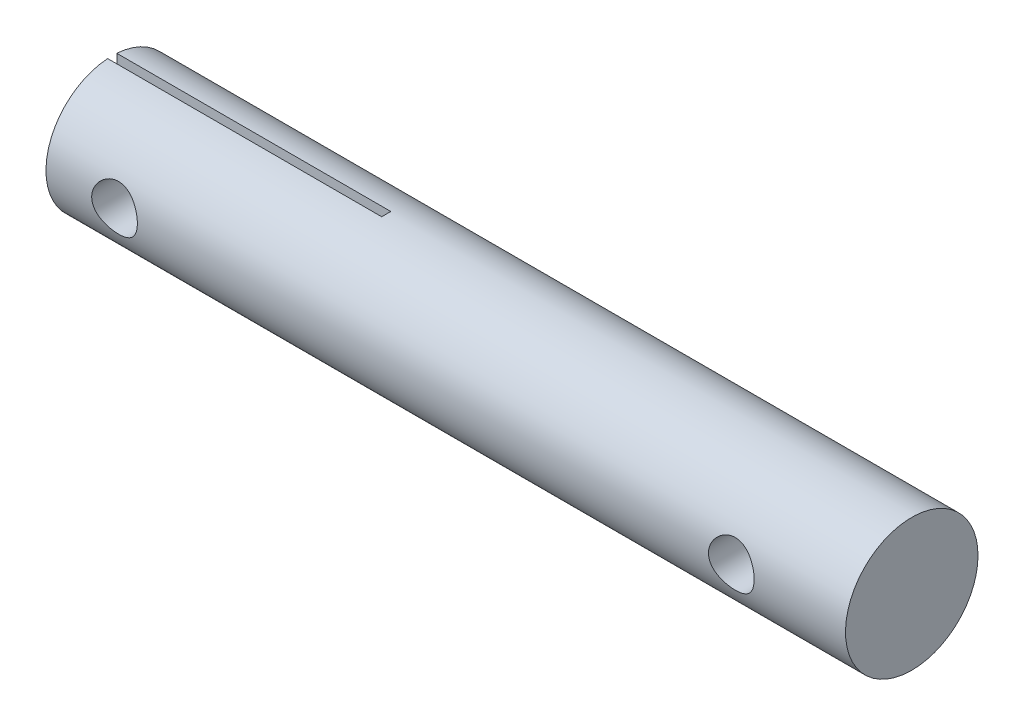
from build123d import *

# Parameters (mm, degrees)
SKETCH_1_R               = 2.9
EXTRUDE_1_DEPTH          = 35
SKETCH_2_W               = 0.4
SKETCH_2_H               = 5.450532248
CUT_EXTRUDE_1_DEPTH      = 12
CUT_EXTRUDE_2_DEPTH      = 10
CUT_EXTRUDE_2_DEPTH_BACK = 10
SKETCH_3_R               = 1


with BuildPart() as part:
    # 草图1 → 凸台-拉伸1 (new body)
    with BuildSketch(Plane(origin=(0, 0, 0), x_dir=(0, 0, -1), z_dir=(1, 0, 0))):
        Circle(SKETCH_1_R)
    extrude(amount=EXTRUDE_1_DEPTH)

    # 草图2 → 切除-拉伸1 (cut)
    with BuildSketch(Plane.ZY):
        with Locations((0, 0.396255312)):
            Rectangle(SKETCH_2_W, SKETCH_2_H)
    extrude(amount=-CUT_EXTRUDE_1_DEPTH, mode=Mode.SUBTRACT)

    # 草图3 → 切除-拉伸2 (cut, two sides: drawn at the far end of the back side and taken through both)
    with BuildSketch(Plane(origin=(0, 0, 0.2), x_dir=(-1, 0, 0), z_dir=(0, 0, -1)).offset(-CUT_EXTRUDE_2_DEPTH_BACK)):
        with Locations(Location((-3, -0.003452386, 0), (0, 0, 270))):
            Circle(SKETCH_3_R)
        with Locations(Location((-30, -0.003452386, 0), (0, 0, 270))):
            Circle(SKETCH_3_R)
    extrude(amount=CUT_EXTRUDE_2_DEPTH + CUT_EXTRUDE_2_DEPTH_BACK, mode=Mode.SUBTRACT)


solid = part.part
